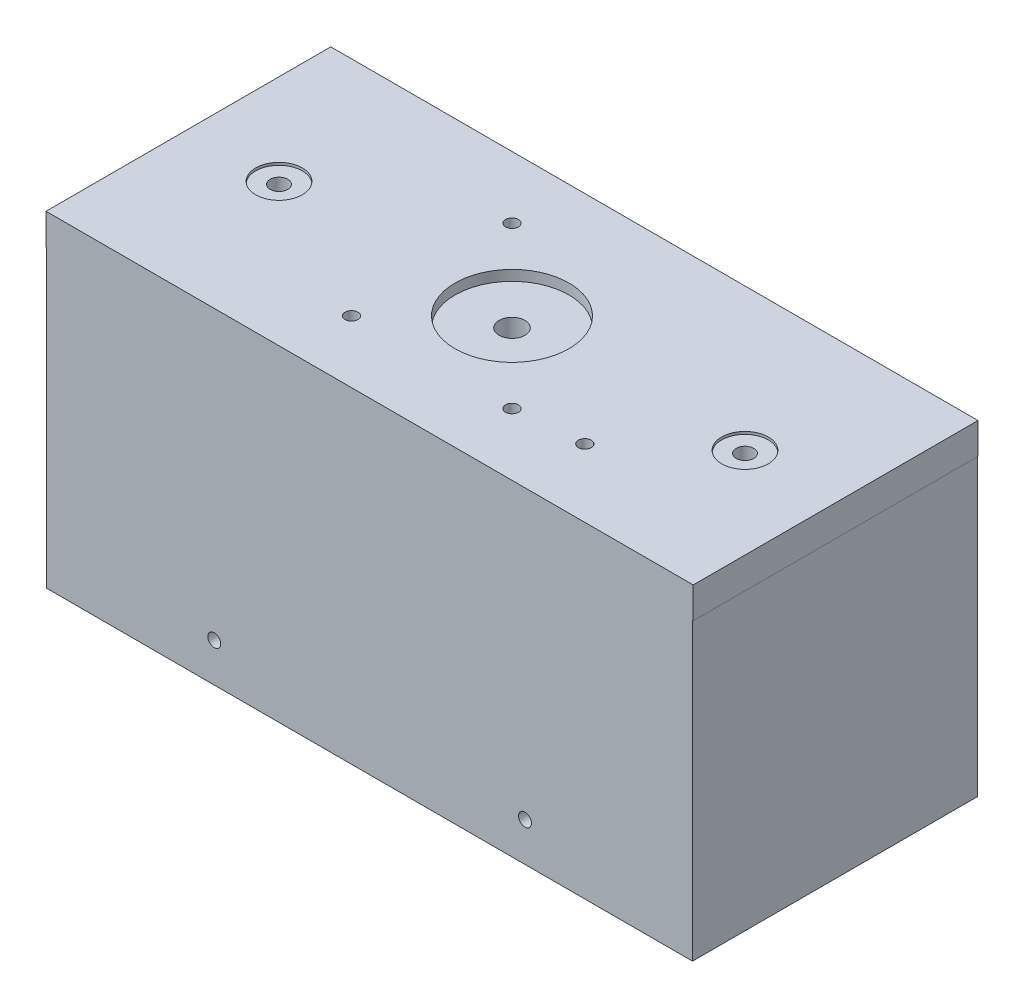
from build123d import *

# Parameters (mm, degrees)
SKETCH_1_W                     = 125
SKETCH_1_H                     = 55
EXTRUDE_1_DEPTH                = 6
SKETCH_2_R                     = 11
CUT_EXTRUDE_1_DEPTH            = 2
CUT_EXTRUDE_2_REACH            = 70.4
SKETCH_3_R                     = 2.5
HOLE_WIZARD_M3_1_D             = 2.5
HOLE_WIZARD_M3_1_DEPTH         = 7.5
HOLE_WIZARD_M3_1_TIP           = 0.751075774
SKETCH_6_W                     = 124.723991502
SKETCH_6_H                     = 55
SKETCH_6_W_2                   = 120
SKETCH_6_H_2                   = 50
EXTRUDE_2_DEPTH                = 57
HOLE_WIZARD_M3_2_D             = 2.5
HOLE_WIZARD_M3_2_DEPTH         = 2.5
HOLE_WIZARD_M3_3_D             = 2.5
HOLE_WIZARD_M3_1_2_D           = 3.4
HOLE_WIZARD_M3_1_2_DEPTH       = 5
HOLE_WIZARD_M3_1_2_CBORE_D     = 9
HOLE_WIZARD_M3_1_2_CBORE_DEPTH = 0.5
HOLE_WIZARD_M3_1_2_TIP         = 1.021463052


with BuildPart() as part:
    # 草图1 → 凸台-拉伸1 (new body)
    with BuildSketch(Plane(origin=(0, 0, 0), x_dir=(1, 0, 0), z_dir=(0, 1, 0))):
        Rectangle(SKETCH_1_W, SKETCH_1_H)
    extrude(amount=EXTRUDE_1_DEPTH)

    # 草图2 → 切除-拉伸1 (cut)
    with BuildSketch(Plane(origin=(0, 6, 0), x_dir=(1, 0, 0), z_dir=(0, 1, 0))):
        with Locations(Location((0, 0, 0), (0, 0, 270))):
            Circle(SKETCH_2_R)
    extrude(amount=-CUT_EXTRUDE_1_DEPTH, mode=Mode.SUBTRACT)

    # 草图3 → 切除-拉伸2 (cut, up to next)
    with BuildSketch(Plane(origin=(0, 4, 0), x_dir=(1, 0, 0), z_dir=(0, 1, 0)), mode=Mode.PRIVATE) as cut_extrude_2_sk1:
        with Locations(Location((0, 0, 0), (0, 0, 270))):
            Circle(SKETCH_3_R)
    cut_extrude_2_tool1 = extrude(cut_extrude_2_sk1.sketch, amount=-CUT_EXTRUDE_2_REACH, mode=Mode.PRIVATE) & part.part
    add(cut_extrude_2_tool1.solids().sort_by_distance((0, 4, 0))[0], mode=Mode.SUBTRACT)

    # Hole Wizard M3 _1
    with Locations(Plane(origin=(0, 6, 0), x_dir=(1, 0, 0), z_dir=(0, 1, 0))):
        with Locations((28.444269766, -14.379484624), (15.5, -15.5), (-15.5, -15.5), (-15.5, 15.5)):
            Hole(HOLE_WIZARD_M3_1_D / 2, depth=HOLE_WIZARD_M3_1_DEPTH)
            with Locations((0, 0, -(HOLE_WIZARD_M3_1_DEPTH + HOLE_WIZARD_M3_1_TIP / 2))):  # 118° drill point
                Cone(0, HOLE_WIZARD_M3_1_D / 2, HOLE_WIZARD_M3_1_TIP, mode=Mode.SUBTRACT)

    # 草图6 → 凸台-拉伸2 (add)
    with BuildSketch(Plane.XZ):
        Rectangle(SKETCH_6_W, SKETCH_6_H)
        Rectangle(SKETCH_6_W_2, SKETCH_6_H_2, mode=Mode.SUBTRACT)
    extrude(amount=EXTRUDE_2_DEPTH)

    # M3 螺纹孔2
    with Locations(Plane(origin=(0, 0, -27.5), x_dir=(-1, 0, 0), z_dir=(0, 0, -1))):
        with Locations((30, -49.5), (-30, -49.5)):
            Hole(HOLE_WIZARD_M3_2_D / 2, depth=HOLE_WIZARD_M3_2_DEPTH)

    # M3 螺纹孔3 (through all)
    with Locations(Plane.XY.offset(27.5)):
        with Locations((30, -49.5), (-30, -49.5)):
            Hole(HOLE_WIZARD_M3_3_D / 2)

    # Hole Wizard M3 _1 2
    with Locations(Plane(origin=(-45, 6, 0), x_dir=(0, 0, 1), z_dir=(0, 1, 0))):
        with Locations((0, 0), (0, 90)):
            CounterBoreHole(HOLE_WIZARD_M3_1_2_D / 2, HOLE_WIZARD_M3_1_2_CBORE_D / 2, HOLE_WIZARD_M3_1_2_CBORE_DEPTH, depth=HOLE_WIZARD_M3_1_2_DEPTH)
            with Locations((0, 0, -(HOLE_WIZARD_M3_1_2_DEPTH + HOLE_WIZARD_M3_1_2_TIP / 2))):  # 118° drill point
                Cone(0, HOLE_WIZARD_M3_1_2_D / 2, HOLE_WIZARD_M3_1_2_TIP, mode=Mode.SUBTRACT)


solid = part.part
